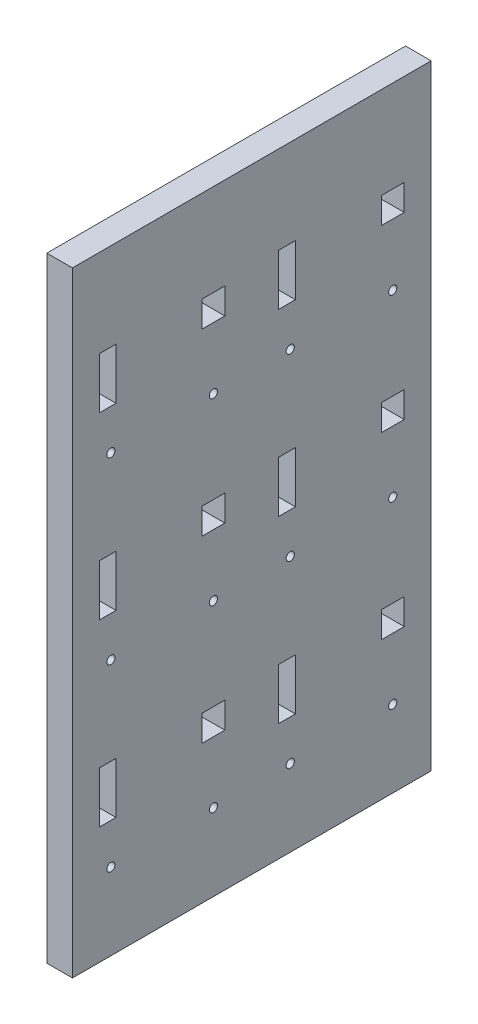
from build123d import *

# Parameters (mm, degrees)
CROQUIS2_W              = 240
CROQUIS2_H              = 140
SALIENTE_EXTRUIR1_DEPTH = 10
CROQUIS3_W              = 20
CROQUIS3_H              = 6.5
CROQUIS3_W_2            = 10.16
CROQUIS3_H_2            = 8.96
CROQUIS3_R              = 1.6
CORTAR_EXTRUIR1_DEPTH   = 279.028775489
MATRIZL1_COUNT          = 3
MATRIZL1_PITCH          = 70
MATRIZL1_COUNT_DIR2     = 2
MATRIZL1_PITCH_DIR2     = 70


with BuildPart() as part:
    # Croquis2 → Saliente-Extruir1 (new body)
    with BuildSketch(Plane.YZ):
        with Locations((120, 70)):
            Rectangle(CROQUIS2_W, CROQUIS2_H)
    extrude(amount=SALIENTE_EXTRUIR1_DEPTH)

    # Croquis3 → Cortar-Extruir1 (cut, symmetric)
    with BuildSketch(Plane.YZ.offset(10)):
        with Locations((55.75, 126.25)):
            Rectangle(CROQUIS3_W, CROQUIS3_H)
        with Locations((59.11, 85)):
            Rectangle(CROQUIS3_W_2, CROQUIS3_H_2)
        with Locations((30, 125)):
            Circle(CROQUIS3_R)
        with Locations((30, 85)):
            Circle(CROQUIS3_R)
    cortar_extruir1 = extrude(amount=CORTAR_EXTRUIR1_DEPTH, both=True, mode=Mode.SUBTRACT)

    # MatrizL1: Cortar-Extruir1 3 × 2
    with Locations(*[(0, i * MATRIZL1_PITCH, -j * MATRIZL1_PITCH_DIR2) for i in range(MATRIZL1_COUNT) for j in range(MATRIZL1_COUNT_DIR2) if (i, j) != (0, 0)]):
        add(cortar_extruir1, mode=Mode.SUBTRACT)


solid = part.part
